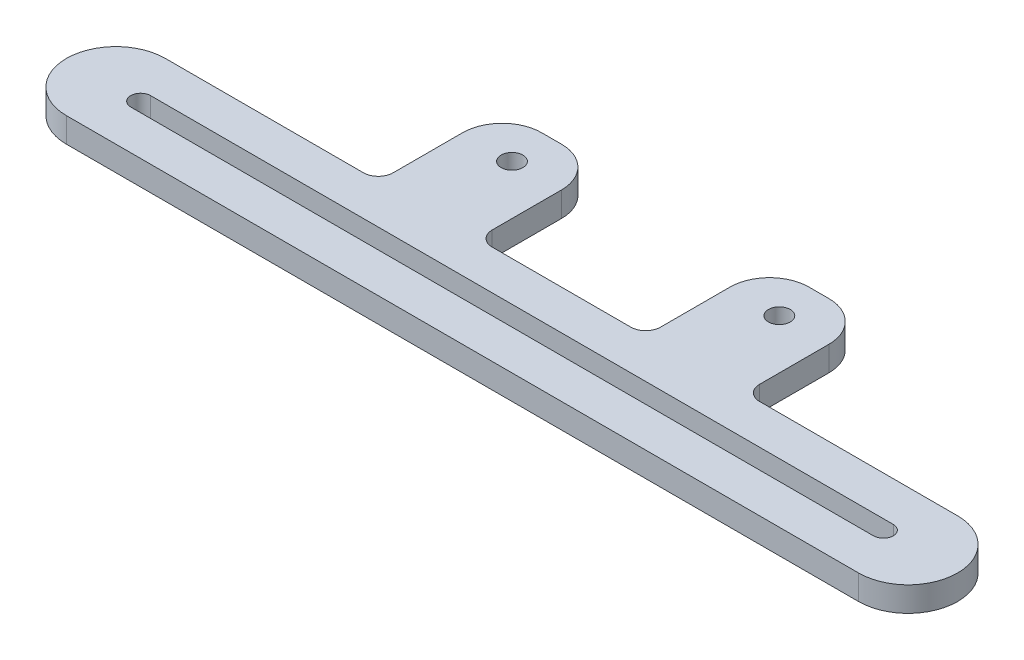
from build123d import *

# Parameters (mm, degrees)
SKETCH1_R           = 2.2
BOSS_EXTRUDE1_DEPTH = 5
FILLET1_R           = 3


with BuildPart() as part:
    # Sketch1 → Boss-Extrude1 (new body)
    with BuildSketch(Plane(origin=(0, 0, 0), x_dir=(1, 0, 0), z_dir=(0, 1, 0))):
        with BuildLine():
            Line((0, 10), (43, 10))
            Line((43, 10), (43, 27))
            ThreePointArc((43, 27), (45.343145751, 32.656854249), (51, 35))
            Line((51, 35), (55, 35))
            ThreePointArc((55, 35), (60.656854249, 32.656854249), (63, 27))
            Line((63, 27), (63, 10))
            Line((63, 10), (97, 10))
            Line((97, 10), (97, 27))
            ThreePointArc((97, 27), (99.343145751, 32.656854249), (105, 35))
            Line((105, 35), (109, 35))
            ThreePointArc((109, 35), (114.656854249, 32.656854249), (117, 27))
            Line((117, 27), (117, 10))
            Line((117, 10), (160, 10))
            ThreePointArc((160, 10), (170, 0), (160, -10))
            Line((160, -10), (0, -10))
            ThreePointArc((0, -10), (-10, 0), (0, 10))
        make_face()
        with Locations((53, 27)):
            Circle(SKETCH1_R, mode=Mode.SUBTRACT)
        with Locations((107, 27)):
            Circle(SKETCH1_R, mode=Mode.SUBTRACT)
        with BuildLine():
            Line((5, 2), (155, 2))
            ThreePointArc((155, 2), (157, 0), (155, -2))
            Line((155, -2), (5, -2))
            ThreePointArc((5, -2), (3, 0), (5, 2))
        make_face(mode=Mode.SUBTRACT)
    extrude(amount=BOSS_EXTRUDE1_DEPTH)

    # Fillet1
    fillet1_edges = [part.edges().sort_by_distance(p)[0] for p in [
        (117, 2.5, -10),
        (97, 2.5, -10),
        (63, 2.5, -10),
        (43, 2.5, -10),
    ]]
    fillet(fillet1_edges, radius=FILLET1_R)


solid = part.part
